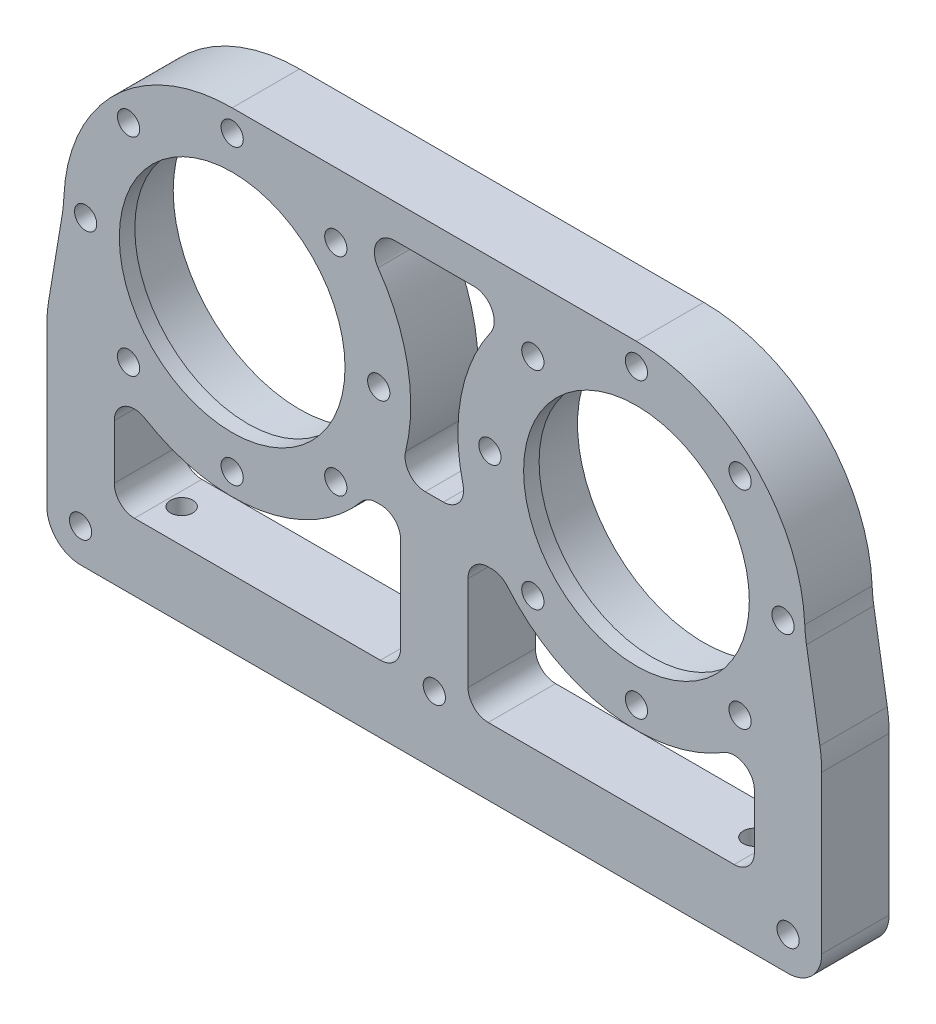
from build123d import *

# Parameters (mm, degrees)
SKETCH_1_R          = 25
SKETCH_1_W          = 115
SKETCH_1_H          = 30
EXTRUDE_1_DEPTH     = 10
FILLET_1_R          = 20
SKETCH_2_R          = 18.75
CUT_EXTRUDE_1_DEPTH = 81.195074662
CUT_EXTRUDE_3_DEPTH = 81.195074662
FILLET_3_R          = 3
SKETCH_5_R          = 1.65
CUT_EXTRUDE_4_DEPTH = 81.195074662
SKETCH_6_R          = 1.65
CUT_EXTRUDE_5_DEPTH = 81.195074662
FILLET_5_R          = 5
SKETCH_7_R          = 18.75
SKETCH_7_R_2        = 16.75
EXTRUDE_2_DEPTH     = 2.3
CUT_EXTRUDE_6_DEPTH = 10
FILLET_6_R          = 3
SKETCH_9_R          = 1.65
CUT_EXTRUDE_7_DEPTH = 10


with BuildPart() as part:
    # ｽｹｯﾁ1 → ﾎﾞｽ - 押し出し1 (new body)
    with BuildSketch(Plane.XY):
        with Locations((30, 30)):
            Circle(SKETCH_1_R)
        with Locations((-30, 30)):
            Circle(SKETCH_1_R)
        Rectangle(SKETCH_1_W, SKETCH_1_H)
        with BuildLine():
            ThreePointArc((-50, 15), (-30, 5), (-10, 15))
            Line((-10, 15), (-50, 15))
        make_face()
        with BuildLine():
            Line((-50, 15), (-10, 15))
            ThreePointArc((-10, 15), (-6.282917549, 22.09430585), (-5, 30))
            ThreePointArc((-5, 30), (-12.32233047, 47.67766953), (-30, 55))
            ThreePointArc((-30, 55), (-47.67766953, 47.67766953), (-55, 30))
            ThreePointArc((-55, 30), (-53.717082451, 22.09430585), (-50, 15))
        make_face()
        with BuildLine():
            Line((-10, 15), (10, 15))
            ThreePointArc((10, 15), (7.639320225, 41.180339887), (30, 55))
            Line((30, 55), (-30, 55))
            ThreePointArc((-30, 55), (-12.32233047, 47.67766953), (-5, 30))
            ThreePointArc((-5, 30), (-6.282917549, 22.09430585), (-10, 15))
        make_face()
        with BuildLine():
            ThreePointArc((10, 15), (30, 5), (50, 15))
            Line((50, 15), (10, 15))
        make_face()
        with BuildLine():
            Line((10, 15), (50, 15))
            ThreePointArc((50, 15), (53.717082451, 22.09430585), (55, 30))
            ThreePointArc((55, 30), (47.67766953, 47.67766953), (30, 55))
            ThreePointArc((30, 55), (7.639320225, 41.180339887), (10, 15))
        make_face()
        with BuildLine():
            Line((50, 15), (57.5, 15))
            Line((57.5, 15), (55, 30))
            ThreePointArc((55, 30), (53.717082451, 22.09430585), (50, 15))
        make_face()
        with BuildLine():
            Line((-55, 30), (-57.5, 15))
            Line((-57.5, 15), (-50, 15))
            ThreePointArc((-50, 15), (-53.717082451, 22.09430585), (-55, 30))
        make_face()
    extrude(amount=EXTRUDE_1_DEPTH)

    # ﾌｨﾚｯﾄ1
    fillet_1_edges = [part.edges().sort_by_distance(p)[0] for p in [
        (55, 30, 5),
        (57.5, 15, 5),
        (-57.5, 15, 5),
        (-55, 30, 5),
    ]]
    fillet(fillet_1_edges, radius=FILLET_1_R)

    # ｽｹｯﾁ2 → ｶｯﾄ - 押し出し1 (cut, through all)
    with BuildSketch(Plane.XY.offset(10)):
        with Locations((30, 30)):
            Circle(SKETCH_2_R)
        with Locations(Location((-30, 30, 0), (0, 0, 180))):
            Circle(SKETCH_2_R)
    extrude(amount=-CUT_EXTRUDE_1_DEPTH, mode=Mode.SUBTRACT)

    # ｽｹｯﾁ4 → ｶｯﾄ - 押し出し3 (cut, through all)
    with BuildSketch(Plane(origin=(0, 0, 0), x_dir=(-1, 0, 0), z_dir=(0, 0, -1))):
        with BuildLine():
            Line((-5, -5), (-5, 15))
            Line((-5, 15), (-10, 15))
            ThreePointArc((-10, 15), (-28.103103333, 5.072068216), (-47.5, 12.146428929))
            Line((-47.5, 12.146428929), (-47.5, -5))
            Line((-47.5, -5), (-5, -5))
        make_face()
        with BuildLine():
            Line((10, 15), (5, 15))
            Line((5, 15), (5, -5))
            Line((5, -5), (47.5, -5))
            Line((47.5, -5), (47.5, 12.146428929))
            ThreePointArc((47.5, 12.146428929), (28.103103333, 5.072068216), (10, 15))
        make_face()
    extrude(amount=-CUT_EXTRUDE_3_DEPTH, mode=Mode.SUBTRACT)

    # ﾌｨﾚｯﾄ3
    fillet_3_edges = [part.edges().sort_by_distance(p)[0] for p in [
        (-47.5, 12.146428929, 5),
        (-47.5, -5, 5),
        (-5, -5, 5),
        (-5, 15, 5),
        (-10, 15, 5),
        (47.5, 12.146428929, 5),
        (10, 15, 5),
        (5, 15, 5),
        (5, -5, 5),
        (47.5, -5, 5),
    ]]
    fillet(fillet_3_edges, radius=FILLET_3_R)

    # ｽｹｯﾁ5 → ｶｯﾄ - 押し出し4 (cut, through all)
    with BuildSketch(Plane(origin=(0, 0, 0), x_dir=(-1, 0, 0), z_dir=(0, 0, -1))):
        with Locations((-30, 51.75)):
            Circle(SKETCH_5_R)
        with Locations((-14.620427509, 45.379572491)):
            Circle(SKETCH_5_R)
        with Locations((-8.25, 30)):
            Circle(SKETCH_5_R)
        with Locations((-14.620427509, 14.620427509)):
            Circle(SKETCH_5_R)
        with Locations((-30, 8.25)):
            Circle(SKETCH_5_R)
        with Locations((-45.379572491, 14.620427509)):
            Circle(SKETCH_5_R)
        with Locations((-51.75, 30)):
            Circle(SKETCH_5_R)
        with Locations((-45.379572491, 45.379572491)):
            Circle(SKETCH_5_R)
        with Locations(Location((45.379572491, 45.379572491, 0), (0, 0, 180))):
            Circle(SKETCH_5_R)
        with Locations(Location((51.75, 30, 0), (0, 0, 180))):
            Circle(SKETCH_5_R)
        with Locations(Location((45.379572491, 14.620427509, 0), (0, 0, 180))):
            Circle(SKETCH_5_R)
        with Locations(Location((30, 8.25, 0), (0, 0, 180))):
            Circle(SKETCH_5_R)
        with Locations(Location((14.620427509, 14.620427509, 0), (0, 0, 180))):
            Circle(SKETCH_5_R)
        with Locations(Location((8.25, 30, 0), (0, 0, 180))):
            Circle(SKETCH_5_R)
        with Locations(Location((14.620427509, 45.379572491, 0), (0, 0, 180))):
            Circle(SKETCH_5_R)
        with Locations(Location((30, 51.75, 0), (0, 0, 180))):
            Circle(SKETCH_5_R)
    extrude(amount=-CUT_EXTRUDE_4_DEPTH, mode=Mode.SUBTRACT)

    # ｽｹｯﾁ6 → ｶｯﾄ - 押し出し5 (cut, through all)
    with BuildSketch(Plane(origin=(0, 0, 0), x_dir=(-1, 0, 0), z_dir=(0, 0, -1))):
        with Locations((-52.5, -10)):
            Circle(SKETCH_6_R)
        with Locations(Location((52.5, -10, 0), (0, 0, 180))):
            Circle(SKETCH_6_R)
        with Locations((0, -5)):
            Circle(SKETCH_6_R)
    extrude(amount=-CUT_EXTRUDE_5_DEPTH, mode=Mode.SUBTRACT)

    # ﾌｨﾚｯﾄ5
    fillet_5_edges = [part.edges().sort_by_distance(p)[0] for p in [
        (57.5, -15, 5),
        (-57.5, -15, 5),
    ]]
    fillet(fillet_5_edges, radius=FILLET_5_R)

    # ｽｹｯﾁ7 → ﾎﾞｽ - 押し出し2 (add)
    # profile 1 of 2: a face of its own
    with BuildSketch(Plane.XY.offset(10)):
        with Locations((-30, 30)):
            Circle(SKETCH_7_R)
        with Locations((-30, 30)):
            Circle(SKETCH_7_R_2, mode=Mode.SUBTRACT)
    # profile 2 of 2: a face of its own
    with BuildSketch(Plane.XY.offset(10)):
        with Locations((30, 30)):
            Circle(SKETCH_7_R)
        with Locations((30, 30)):
            Circle(SKETCH_7_R_2, mode=Mode.SUBTRACT)
    extrude(amount=-EXTRUDE_2_DEPTH)

    # ｽｹｯﾁ8 → ｶｯﾄ - 押し出し6 (cut)
    with BuildSketch(Plane(origin=(0, 0, 0), x_dir=(-1, 0, 0), z_dir=(0, 0, -1))):
        with BuildLine():
            Line((-5.459217616, 20), (0, 20))
            Line((0, 20), (0, 50))
            Line((0, 50), (-12.614661349, 50))
            ThreePointArc((-12.614661349, 50), (-5.886088307, 40.989506944), (-3.5, 30))
            ThreePointArc((-3.5, 30), (-3.994416627, 24.904940293), (-5.459217616, 20))
        make_face()
        with BuildLine():
            Line((0, 50), (0, 20))
            Line((0, 20), (5.459217616, 20))
            ThreePointArc((5.459217616, 20), (4.223074151, 36.148178084), (12.614661349, 50))
            Line((12.614661349, 50), (0, 50))
        make_face()
    extrude(amount=-CUT_EXTRUDE_6_DEPTH, mode=Mode.SUBTRACT)

    # ﾌｨﾚｯﾄ6
    fillet_6_edges = [part.edges().sort_by_distance(p)[0] for p in [
        (-5.459217616, 20, 5),
        (5.459217616, 20, 5),
        (12.614661349, 50, 5),
        (-12.614661349, 50, 5),
    ]]
    fillet(fillet_6_edges, radius=FILLET_6_R)

    # ｽｹｯﾁ9 → ｶｯﾄ - 押し出し7 (cut)
    with BuildSketch(Plane.XZ.offset(15)):
        with Locations((-42.5, 5)):
            Circle(SKETCH_9_R)
        with Locations(Location((42.5, 5, 0), (0, 0, 180))):
            Circle(SKETCH_9_R)
    extrude(amount=-CUT_EXTRUDE_7_DEPTH, mode=Mode.SUBTRACT)


solid = part.part
